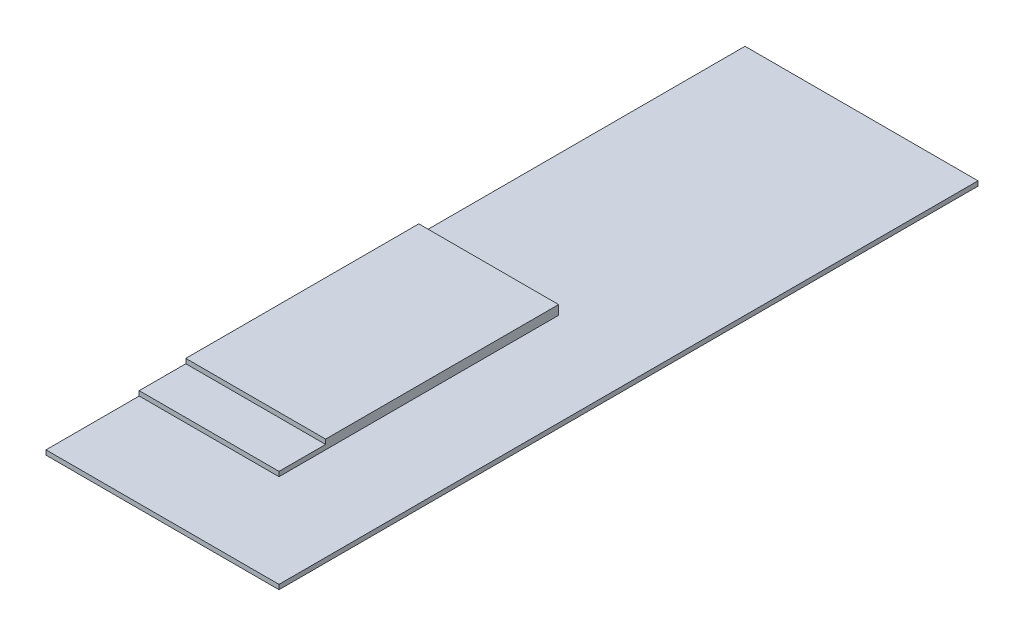
from build123d import *

# Parameters (mm, degrees)
CROQUIS1_W              = 3000
CROQUIS1_H              = 8000
SALIENTE_EXTRUIR1_DEPTH = 100
CROQUIS2_W              = 3000
CROQUIS2_H              = 6000
SALIENTE_EXTRUIR2_DEPTH = 100
CROQUIS3_W              = 3000
CROQUIS3_H              = 5000
SALIENTE_EXTRUIR3_DEPTH = 100
CROQUIS5_W              = 5000
CROQUIS5_H              = 15000
SALIENTE_EXTRUIR4_DEPTH = 100


with BuildPart() as part:
    # Croquis1 → Saliente-Extruir1 (new body)
    with BuildSketch(Plane(origin=(0, 0, 0), x_dir=(1, 0, 0), z_dir=(0, 1, 0))):
        with Locations((-1063.636363636, -1781.818181818)):
            Rectangle(CROQUIS1_W, CROQUIS1_H)
    extrude(amount=SALIENTE_EXTRUIR1_DEPTH)

    # Croquis2 → Saliente-Extruir2 (add)
    with BuildSketch(Plane(origin=(0, 100, 0), x_dir=(1, 0, 0), z_dir=(0, 1, 0))):
        with Locations((-1063.636363636, -781.818181818)):
            Rectangle(CROQUIS2_W, CROQUIS2_H)
    extrude(amount=SALIENTE_EXTRUIR2_DEPTH)

    # Croquis3 → Saliente-Extruir3 (add)
    with BuildSketch(Plane(origin=(0, 200, 0), x_dir=(1, 0, 0), z_dir=(0, 1, 0))):
        with Locations((-1063.636363636, -281.818181818)):
            Rectangle(CROQUIS3_W, CROQUIS3_H)
    extrude(amount=SALIENTE_EXTRUIR3_DEPTH)

    # Croquis5 → Saliente-Extruir4 (add)
    with BuildSketch(Plane(origin=(0, 100, 0), x_dir=(1, 0, 0), z_dir=(0, 1, 0))):
        with Locations((-63.636363636, 1718.181818182)):
            Rectangle(CROQUIS5_W, CROQUIS5_H)
    extrude(amount=-SALIENTE_EXTRUIR4_DEPTH)


solid = part.part
